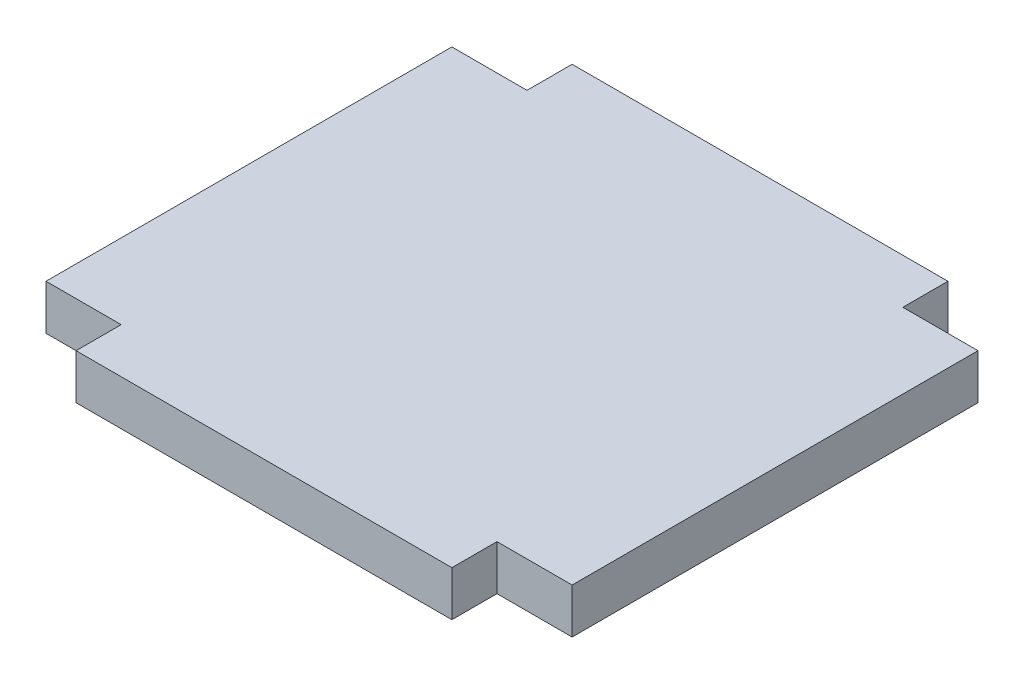
from build123d import *

# Parameters (mm, degrees)
ESTRUSIONE_ESTRUSIONE1_DEPTH      = 30
ESTRUSIONE_ESTRUSIONE1_DEPTH_BACK = 3
SCHIZZO1_W                        = 25
SCHIZZO1_H                        = 3
SCHIZZO2_W                        = 27
SCHIZZO2_H                        = 3
ESTRUSIONE_ESTRUSIONE2_DEPTH      = 5


with BuildPart() as part:
    # Schizzo1 → Estrusione-Estrusione1 (new, two sides: drawn at the far end of the back side and taken through both)
    with BuildSketch(Plane.XY.offset(-ESTRUSIONE_ESTRUSIONE1_DEPTH_BACK)):
        with Locations((35.5, -54.5)):
            Rectangle(SCHIZZO1_W, SCHIZZO1_H)
    extrude(amount=ESTRUSIONE_ESTRUSIONE1_DEPTH + ESTRUSIONE_ESTRUSIONE1_DEPTH_BACK)

    # Schizzo2 → Estrusione-Estrusione2 (add)
    with BuildSketch(Plane(origin=(48, 0, 0), x_dir=(0, 0, -1), z_dir=(1, 0, 0))):
        with Locations((-13.5, -54.5)):
            Rectangle(SCHIZZO2_W, SCHIZZO2_H)
    estrusione_estrusione2 = extrude(amount=ESTRUSIONE_ESTRUSIONE2_DEPTH)

    # Specchia1: Estrusione-Estrusione2 across plane
    add(estrusione_estrusione2.mirror(Plane(origin=(35.5, 0, 0), x_dir=(0, 0, 1), z_dir=(1, 0, 0))))


solid = part.part
